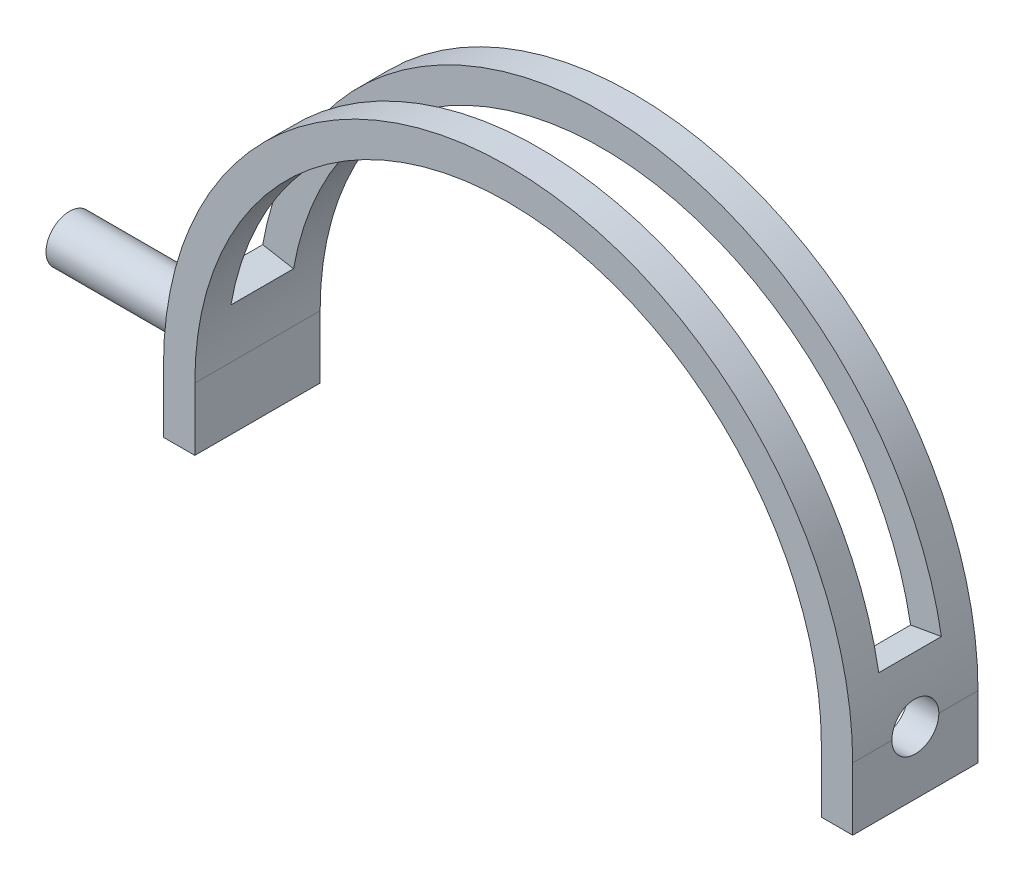
from build123d import *

# Parameters (mm, degrees)
BOSS_EXTRUDE1_DEPTH      = 10
BOSS_EXTRUDE1_DEPTH_BACK = 10
CUT_EXTRUDE1_DEPTH       = 5
CUT_EXTRUDE1_DEPTH_BACK  = 5
SKETCH4_R                = 3.75
BOSS_EXTRUDE2_DEPTH      = 25
SKETCH5_R                = 3.75
CUT_EXTRUDE3_DEPTH       = 25


with BuildPart() as part:
    # Sketch1 → Boss-Extrude1 (new, two sides: drawn at the far end of the back side and taken through both)
    with BuildSketch(Plane.XY.offset(-BOSS_EXTRUDE1_DEPTH_BACK)):
        with BuildLine():
            Line((-55, -10), (-50, -10))
            Line((-50, -10), (-50, 0))
            ThreePointArc((-50, 0), (0, 50), (50, 0))
            Line((50, 0), (50, -10))
            Line((50, -10), (55, -10))
            Line((55, -10), (55, 0))
            ThreePointArc((55, 0), (0, 55), (-55, 0))
            Line((-55, 0), (-55, -10))
        make_face()
    extrude(amount=BOSS_EXTRUDE1_DEPTH + BOSS_EXTRUDE1_DEPTH_BACK)

    # Sketch2 → Cut-Extrude1 (cut, two sides: drawn at the far end of the back side and taken through both)
    with BuildSketch(Plane.XY.offset(-CUT_EXTRUDE1_DEPTH_BACK)):
        with BuildLine():
            Line((0, 0), (-54.164426416, 9.550649772))
            ThreePointArc((-54.164426416, 9.550649772), (0, 55), (54.164426416, 9.550649772))
            Line((54.164426416, 9.550649772), (0, 0))
        make_face()
    extrude(amount=CUT_EXTRUDE1_DEPTH + CUT_EXTRUDE1_DEPTH_BACK, mode=Mode.SUBTRACT)

    # Sketch4 → Boss-Extrude2 (add)
    with BuildSketch(Plane.ZY.offset(55)):
        Circle(SKETCH4_R)
    extrude(amount=BOSS_EXTRUDE2_DEPTH)

    # Sketch5 → Cut-Extrude3 (cut)
    with BuildSketch(Plane(origin=(55, 0, 0), x_dir=(0, 0, -1), z_dir=(1, 0, 0))):
        Circle(SKETCH5_R)
    extrude(amount=-CUT_EXTRUDE3_DEPTH, mode=Mode.SUBTRACT)


solid = part.part
